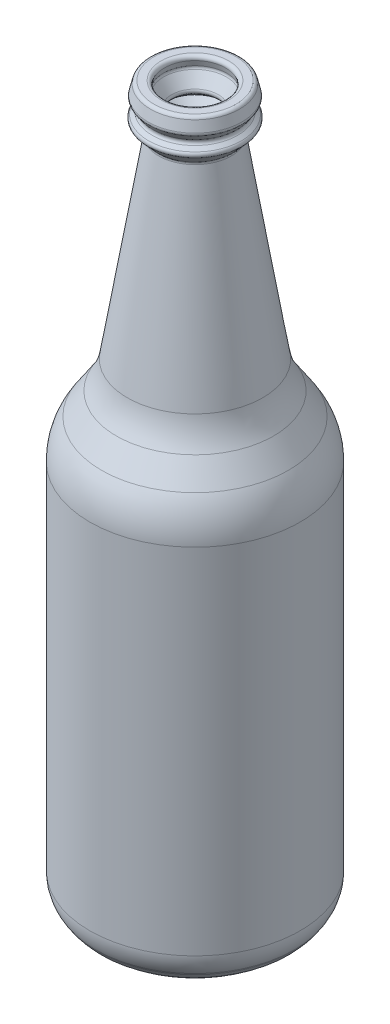
from build123d import *

# Parameters (mm, degrees)
SHELL1_T  = -4
FILLET1_R = 20
FILLET2_R = 10
FILLET3_R = 1


with BuildPart() as part:
    # Sketch1 → Revolve1 (revolve)
    with BuildSketch(Plane.XY, mode=Mode.PRIVATE) as revolve1_sk:
        Polygon((12.5, 47.786738162), (13.5, 43.786738162), (11.5, 40.90556163), (14, 38.786738162), (10.282805704, 34.786738162), (20, -25.213261838), (30, -40.213261838), (30, -150.213261838), (25, -157.713261838), (0, -157.713261838), (0, 47.786738162), align=None)
    revolve(revolve1_sk.sketch.rotate(Axis((0, 47.786738162, 0), (0, -1, 0)), 90), axis=Axis((0, 47.786738162, 0), (0, -1, 0)))

    # Shell1
    shell1_openings = [part.faces().sort_by_distance(p)[0] for p in [
        (0, 47.786738162, 0),
    ]]
    offset(amount=SHELL1_T, openings=shell1_openings, kind=Kind.INTERSECTION)

    # Fillet1
    fillet1_edges = [part.edges().sort_by_distance(p)[0] for p in [
        (0, -40.213261838, -30),
        (0, -25.213261838, -20),
    ]]
    fillet(fillet1_edges, radius=FILLET1_R)

    # Fillet2
    fillet2_edges = [part.edges().sort_by_distance(p)[0] for p in [
        (0, -157.713261838, -25),
        (0, -150.213261838, -30),
    ]]
    fillet(fillet2_edges, radius=FILLET2_R)

    # Fillet3
    fillet3_edges = [part.edges().sort_by_distance(p)[0] for p in [
        (0, 34.786738162, -10.282805704),
        (0, 38.786738162, -14),
        (0, 40.90556163, -11.5),
        (0, 43.786738162, -13.5),
        (0, 47.786738162, -12.5),
        (0, 47.786738162, -8.376894374),
        (0, 44.577027351, -9.179322077),
        (0, 40.202605101, -6.142769335),
        (0, 36.077389089, -6.021662442),
    ]]
    fillet(fillet3_edges, radius=FILLET3_R)


solid = part.part
